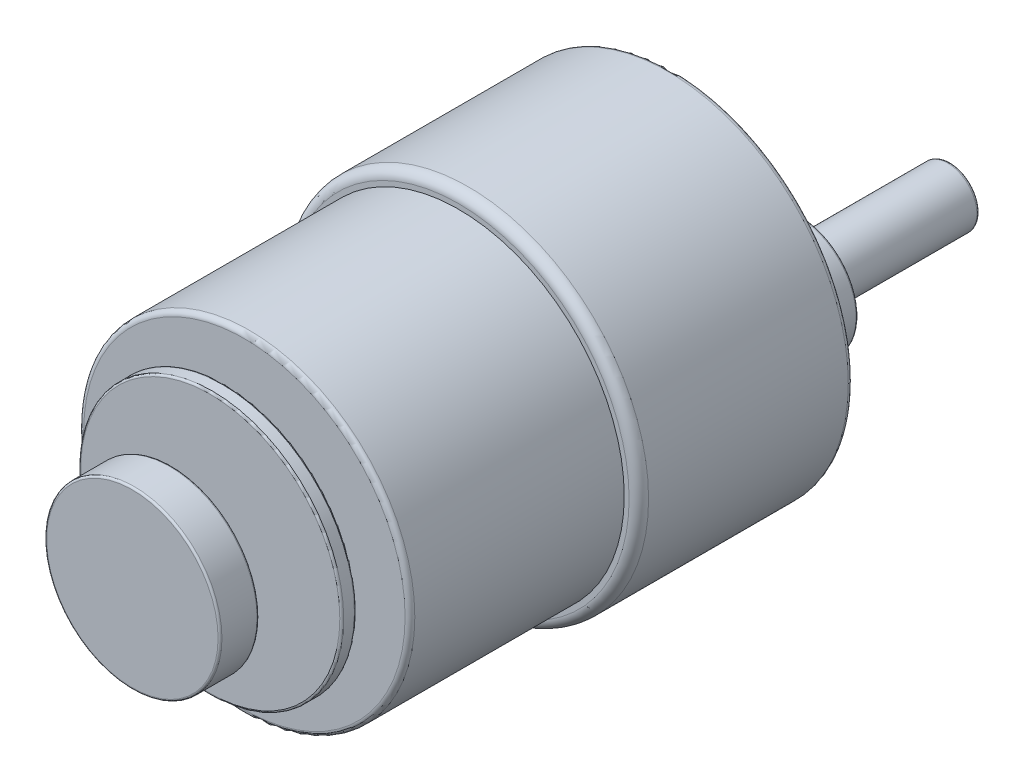
from build123d import *

# Parameters (mm, degrees)
SKETCH_1_R       = 17
EXTRUDE_2_DEPTH  = 22
SKETCH_3_R       = 18.5
EXTRUDE_4_DEPTH  = 22
SKETCH_4_R       = 6
EXTRUDE_5_DEPTH  = 6
SKETCH_5_R       = 3
EXTRUDE_6_DEPTH  = 15.5
SKETCH_14_R      = 3
EXTRUDE_7_DEPTH  = 2
SKETCH_16_R      = 13.5
EXTRUDE_8_DEPTH  = 1.5
SKETCH_17_R      = 1
EXTRUDE_9_DEPTH  = 4
SKETCH_18_R      = 9
EXTRUDE_10_DEPTH = 4
FILLET_2_R       = 0.5
FILLET_3_R       = 0.5
FILLET_4_R       = 0.2
FILLET_5_R       = 0.2
FILLET_6_R       = 0.2
FILLET_7_R       = 0.2
FILLET_8_R       = 0.2
FILLET_9_R       = 0.3
FILLET_10_R      = 1


with BuildPart() as part:
    # 草图1 → 凸台-拉伸2 (new body)
    with BuildSketch(Plane.XY):
        Circle(SKETCH_1_R)
    extrude(amount=EXTRUDE_2_DEPTH)

    # 草图3 → 凸台-拉伸4 (add)
    with BuildSketch(Plane(origin=(0, 0, 0), x_dir=(-1, 0, 0), z_dir=(0, 0, -1))):
        Circle(SKETCH_3_R)
    extrude(amount=EXTRUDE_4_DEPTH)

    # 草图4 → 凸台-拉伸5 (add)
    with BuildSketch(Plane(origin=(0, 0, -22), x_dir=(-1, 0, 0), z_dir=(0, 0, -1))):
        with Locations((-7, 0)):
            Circle(SKETCH_4_R)
    extrude(amount=EXTRUDE_5_DEPTH)

    # 草图5 → 凸台-拉伸6 (add)
    with BuildSketch(Plane(origin=(0, 0, -28), x_dir=(-1, 0, 0), z_dir=(0, 0, -1))):
        with Locations((-7, 0)):
            Circle(SKETCH_5_R)
    extrude(amount=EXTRUDE_6_DEPTH)

    # 草图14 → 凸台-拉伸7 (add)
    with BuildSketch(Plane.XY.offset(22)):
        Circle(SKETCH_14_R)
    extrude(amount=EXTRUDE_7_DEPTH)

    # 草图16 → 凸台-拉伸8 (add)
    with BuildSketch(Plane.XY.offset(24)):
        Circle(SKETCH_16_R)
    extrude(amount=EXTRUDE_8_DEPTH)

    # 草图17 → 凸台-拉伸9 (add)
    with BuildSketch(Plane.XY.offset(25.5)):
        Circle(SKETCH_17_R)
    extrude(amount=EXTRUDE_9_DEPTH)

    # 草图18 → 凸台-拉伸10 (add)
    with BuildSketch(Plane.XY.offset(29.5)):
        Circle(SKETCH_18_R)
    extrude(amount=EXTRUDE_10_DEPTH)

    # 圆角2
    fillet_2_edges = [part.edges().sort_by_distance(p)[0] for p in [
        (-17, 0, 22),
    ]]
    fillet(fillet_2_edges, radius=FILLET_2_R)

    # 圆角3
    fillet_3_edges = [part.edges().sort_by_distance(p)[0] for p in [
        (18.5, 0, -22),
    ]]
    fillet(fillet_3_edges, radius=FILLET_3_R)

    # 圆角4
    fillet_4_edges = [part.edges().sort_by_distance(p)[0] for p in [
        (-13.5, 0, 25.5),
    ]]
    fillet(fillet_4_edges, radius=FILLET_4_R)

    # 圆角5
    fillet_5_edges = [part.edges().sort_by_distance(p)[0] for p in [
        (-13.5, 0, 24),
    ]]
    fillet(fillet_5_edges, radius=FILLET_5_R)

    # 圆角6
    fillet_6_edges = [part.edges().sort_by_distance(p)[0] for p in [
        (-9, 0, 33.5),
    ]]
    fillet(fillet_6_edges, radius=FILLET_6_R)

    # 圆角7
    fillet_7_edges = [part.edges().sort_by_distance(p)[0] for p in [
        (-9, 0, 29.5),
    ]]
    fillet(fillet_7_edges, radius=FILLET_7_R)

    # 圆角8
    fillet_8_edges = [part.edges().sort_by_distance(p)[0] for p in [
        (13, 0, -28),
    ]]
    fillet(fillet_8_edges, radius=FILLET_8_R)

    # 圆角9
    fillet_9_edges = [part.edges().sort_by_distance(p)[0] for p in [
        (10, 0, -43.5),
    ]]
    fillet(fillet_9_edges, radius=FILLET_9_R)

    # 圆角10
    fillet_10_edges = [part.edges().sort_by_distance(p)[0] for p in [
        (18.5, 0, 0),
    ]]
    fillet(fillet_10_edges, radius=FILLET_10_R)


solid = part.part
